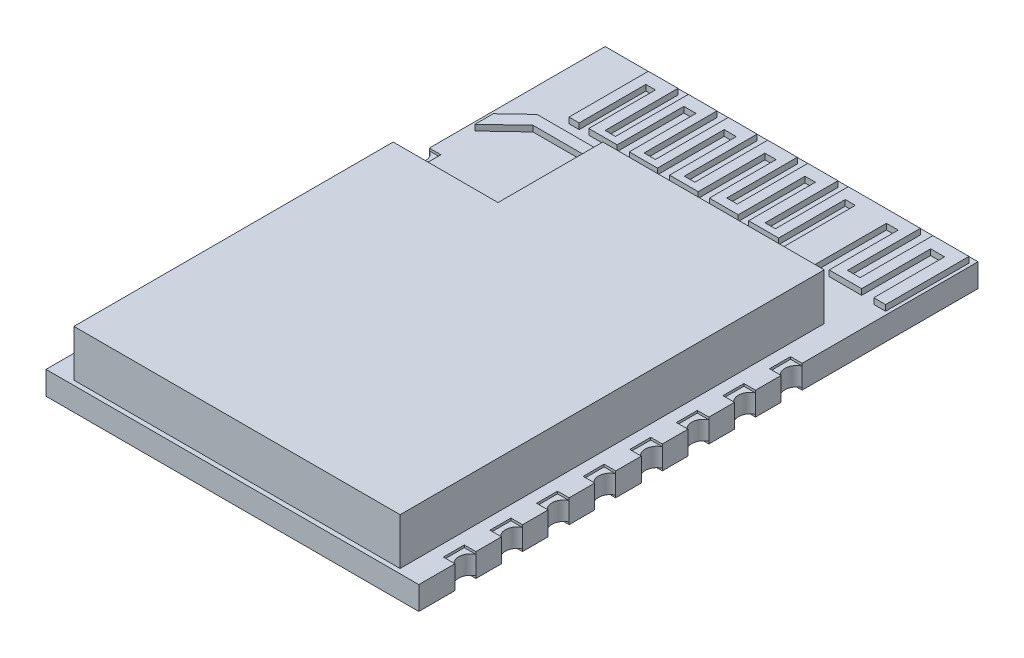
from build123d import *

# Parameters (mm, degrees)
SKETCH_1_W          = 16
SKETCH_1_H          = 24
EXTRUDE_1_DEPTH     = 1
SKETCH_2_W          = 0.497014283
SKETCH_2_H          = 0.9
SKETCH_2_W_2        = 0.5
CUT_EXTRUDE_1_DEPTH = 0.1
SKETCH_3_W          = 1
SKETCH_3_H          = 0.9
CUT_EXTRUDE_2_DEPTH = 0.1
SKETCH_8_W          = 4.7
SKETCH_8_H          = 4.7
CUT_EXTRUDE_3_DEPTH = 0.1
SKETCH_12_R         = 0.2
CUT_EXTRUDE_4_DEPTH = 0.1
SKETCH_13_W         = 4.7
SKETCH_13_H         = 4.7
EXTRUDE_2_DEPTH     = 0.5
SKETCH_15_W         = 4.7
SKETCH_15_H         = 4.7
CUT_EXTRUDE_5_DEPTH = 0.1
SKETCH_16_R         = 0.2
CUT_EXTRUDE_6_DEPTH = 0.25
EXTRUDE_4_DEPTH     = 2
CUT_EXTRUDE_7_DEPTH = 2
SKETCH_19_W         = 14
SKETCH_19_H         = 1.002469934
EXTRUDE_5_DEPTH     = 2
EXTRUDE_7_DEPTH     = 0.25


with BuildPart() as part:
    # 草圖1 → 填料-伸長1 (new body)
    with BuildSketch(Plane(origin=(0, 0, 0), x_dir=(1, 0, 0), z_dir=(0, 1, 0))):
        Rectangle(SKETCH_1_W, SKETCH_1_H)
    extrude(amount=EXTRUDE_1_DEPTH)

    # 草圖2 → 除料-伸長1 (cut)
    with BuildSketch(Plane(origin=(0, 1, 0), x_dir=(1, 0, 0), z_dir=(0, 1, 0))):
        with Locations((-7.751492859, 1.999997771)):
            Rectangle(SKETCH_2_W, SKETCH_2_H)
        with Locations((-7.751492859, -2.229e-06)):
            Rectangle(SKETCH_2_W, SKETCH_2_H)
        with Locations((-7.751492859, -2.000002229)):
            Rectangle(SKETCH_2_W, SKETCH_2_H)
        with Locations((-7.751492859, -4.000002229)):
            Rectangle(SKETCH_2_W, SKETCH_2_H)
        with Locations((-7.751492859, -6.000002229)):
            Rectangle(SKETCH_2_W, SKETCH_2_H)
        with Locations((-7.751492859, -8.000002229)):
            Rectangle(SKETCH_2_W, SKETCH_2_H)
        with Locations((-7.751492859, -10.000002229)):
            Rectangle(SKETCH_2_W, SKETCH_2_H)
        with Locations((7.751492859, -10.000002229)):
            Rectangle(SKETCH_2_W, SKETCH_2_H)
        with Locations((7.751492859, -8.000002229)):
            Rectangle(SKETCH_2_W, SKETCH_2_H)
        with Locations((7.751492859, -6.000002229)):
            Rectangle(SKETCH_2_W, SKETCH_2_H)
        with Locations((7.751492859, -4.000002229)):
            Rectangle(SKETCH_2_W, SKETCH_2_H)
        with Locations((7.751492859, -2.000002229)):
            Rectangle(SKETCH_2_W, SKETCH_2_H)
        with Locations((7.751492859, -2.229e-06)):
            Rectangle(SKETCH_2_W, SKETCH_2_H)
        with Locations((7.751492859, 3.999997771)):
            Rectangle(SKETCH_2_W, SKETCH_2_H)
        with Locations((7.751492859, 1.999997771)):
            Rectangle(SKETCH_2_W, SKETCH_2_H)
        with Locations((-7.752985717, 3.999997771)):
            Rectangle(SKETCH_2_W_2, SKETCH_2_H)
    extrude(amount=-CUT_EXTRUDE_1_DEPTH, mode=Mode.SUBTRACT)

    # 草圖3 → 除料-伸長2 (cut)
    with BuildSketch(Plane.XZ):
        with Locations((7.5, 8)):
            Rectangle(SKETCH_3_W, SKETCH_3_H)
        with Locations((7.5, 10)):
            Rectangle(SKETCH_3_W, SKETCH_3_H)
        with Locations((7.5, 6)):
            Rectangle(SKETCH_3_W, SKETCH_3_H)
        with Locations((7.5, 4)):
            Rectangle(SKETCH_3_W, SKETCH_3_H)
        with Locations((7.5, 2)):
            Rectangle(SKETCH_3_W, SKETCH_3_H)
        with Locations((7.5, 0)):
            Rectangle(SKETCH_3_W, SKETCH_3_H)
        with Locations((7.5, -2)):
            Rectangle(SKETCH_3_W, SKETCH_3_H)
        with Locations((7.5, -4)):
            Rectangle(SKETCH_3_W, SKETCH_3_H)
        with Locations((-7.5, 10)):
            Rectangle(SKETCH_3_W, SKETCH_3_H)
        with Locations((-7.5, -4)):
            Rectangle(SKETCH_3_W, SKETCH_3_H)
        with Locations((-7.5, -2)):
            Rectangle(SKETCH_3_W, SKETCH_3_H)
        with Locations((-7.5, 0)):
            Rectangle(SKETCH_3_W, SKETCH_3_H)
        with Locations((-7.5, 2)):
            Rectangle(SKETCH_3_W, SKETCH_3_H)
        with Locations((-7.5, 4)):
            Rectangle(SKETCH_3_W, SKETCH_3_H)
        with Locations((-7.5, 6)):
            Rectangle(SKETCH_3_W, SKETCH_3_H)
        with Locations((-7.5, 8)):
            Rectangle(SKETCH_3_W, SKETCH_3_H)
    extrude(amount=-CUT_EXTRUDE_2_DEPTH, mode=Mode.SUBTRACT)

    # 草圖8 → 除料-伸長3 (cut)
    with BuildSketch(Plane(origin=(0, 1, 0), x_dir=(1, 0, 0), z_dir=(0, 1, 0))):
        with Locations((1.35, -1.75)):
            Rectangle(SKETCH_8_W, SKETCH_8_H)
    extrude(amount=-CUT_EXTRUDE_3_DEPTH, mode=Mode.SUBTRACT)

    # 草圖12 → 除料-伸長4 (cut)
    with BuildSketch(Plane(origin=(0, 0.9, 0), x_dir=(1, 0, 0), z_dir=(0, 1, 0))):
        with Locations(Location((-0.51, -3.65, 0), (0, 0, 270))):
            Circle(SKETCH_12_R)
        with Locations(Location((0.42, -3.65, 0), (0, 0, 270))):
            Circle(SKETCH_12_R)
        with Locations(Location((1.35, -3.65, 0), (0, 0, 270))):
            Circle(SKETCH_12_R)
        with Locations(Location((2.28, -3.65, 0), (0, 0, 270))):
            Circle(SKETCH_12_R)
        with Locations(Location((3.21, -3.65, 0), (0, 0, 270))):
            Circle(SKETCH_12_R)
        with Locations(Location((-0.51, -2.72, 0), (0, 0, 270))):
            Circle(SKETCH_12_R)
        with Locations(Location((0.42, -2.72, 0), (0, 0, 270))):
            Circle(SKETCH_12_R)
        with Locations(Location((1.35, -2.72, 0), (0, 0, 270))):
            Circle(SKETCH_12_R)
        with Locations(Location((2.28, -2.72, 0), (0, 0, 270))):
            Circle(SKETCH_12_R)
        with Locations(Location((3.21, -2.72, 0), (0, 0, 270))):
            Circle(SKETCH_12_R)
        with Locations(Location((-0.51, -1.79, 0), (0, 0, 270))):
            Circle(SKETCH_12_R)
        with Locations(Location((0.42, -1.79, 0), (0, 0, 270))):
            Circle(SKETCH_12_R)
        with Locations(Location((1.35, -1.79, 0), (0, 0, 270))):
            Circle(SKETCH_12_R)
        with Locations(Location((2.28, -1.79, 0), (0, 0, 270))):
            Circle(SKETCH_12_R)
        with Locations(Location((3.21, -1.79, 0), (0, 0, 270))):
            Circle(SKETCH_12_R)
        with Locations(Location((-0.51, -0.86, 0), (0, 0, 270))):
            Circle(SKETCH_12_R)
        with Locations(Location((0.42, -0.86, 0), (0, 0, 270))):
            Circle(SKETCH_12_R)
        with Locations(Location((1.35, -0.86, 0), (0, 0, 270))):
            Circle(SKETCH_12_R)
        with Locations(Location((2.28, -0.86, 0), (0, 0, 270))):
            Circle(SKETCH_12_R)
        with Locations(Location((3.21, -0.86, 0), (0, 0, 270))):
            Circle(SKETCH_12_R)
        with Locations(Location((-0.51, 0.07, 0), (0, 0, 270))):
            Circle(SKETCH_12_R)
        with Locations(Location((0.42, 0.07, 0), (0, 0, 270))):
            Circle(SKETCH_12_R)
        with Locations(Location((1.35, 0.07, 0), (0, 0, 270))):
            Circle(SKETCH_12_R)
        with Locations(Location((2.28, 0.07, 0), (0, 0, 270))):
            Circle(SKETCH_12_R)
        with Locations(Location((3.21, 0.07, 0), (0, 0, 270))):
            Circle(SKETCH_12_R)
    extrude(amount=-CUT_EXTRUDE_4_DEPTH, mode=Mode.SUBTRACT)

    # 草圖13 → 填料-伸長2 (add)
    with BuildSketch(Plane(origin=(0, 1, 0), x_dir=(1, 0, 0), z_dir=(0, 1, 0))):
        with Locations((1.35, -1.75)):
            Rectangle(SKETCH_13_W, SKETCH_13_H)
    extrude(amount=-EXTRUDE_2_DEPTH)

    # 草圖15 → 除料-伸長5 (cut)
    with BuildSketch(Plane.XZ):
        with Locations((-1.35, 1.75)):
            Rectangle(SKETCH_15_W, SKETCH_15_H)
    extrude(amount=-CUT_EXTRUDE_5_DEPTH, mode=Mode.SUBTRACT)

    # 草圖16 → 除料-伸長6 (cut)
    with BuildSketch(Plane.XZ):
        with Locations(Location((0.51, 3.61, 0), (0, 0, 270))):
            Circle(SKETCH_16_R)
        with Locations(Location((-0.42, 3.61, 0), (0, 0, 270))):
            Circle(SKETCH_16_R)
        with Locations(Location((-1.35, 3.61, 0), (0, 0, 270))):
            Circle(SKETCH_16_R)
        with Locations(Location((-2.28, 3.61, 0), (0, 0, 270))):
            Circle(SKETCH_16_R)
        with Locations(Location((-3.21, 3.61, 0), (0, 0, 270))):
            Circle(SKETCH_16_R)
        with Locations(Location((-3.21, 2.68, 0), (0, 0, 270))):
            Circle(SKETCH_16_R)
        with Locations(Location((-2.28, 2.68, 0), (0, 0, 270))):
            Circle(SKETCH_16_R)
        with Locations(Location((-1.35, 2.68, 0), (0, 0, 270))):
            Circle(SKETCH_16_R)
        with Locations(Location((-0.42, 2.68, 0), (0, 0, 270))):
            Circle(SKETCH_16_R)
        with Locations(Location((0.51, 2.68, 0), (0, 0, 270))):
            Circle(SKETCH_16_R)
        with Locations(Location((-3.21, 1.75, 0), (0, 0, 270))):
            Circle(SKETCH_16_R)
        with Locations(Location((-2.28, 1.75, 0), (0, 0, 270))):
            Circle(SKETCH_16_R)
        with Locations(Location((-1.35, 1.75, 0), (0, 0, 270))):
            Circle(SKETCH_16_R)
        with Locations(Location((-0.42, 1.75, 0), (0, 0, 270))):
            Circle(SKETCH_16_R)
        with Locations(Location((0.51, 1.75, 0), (0, 0, 270))):
            Circle(SKETCH_16_R)
        with Locations(Location((-3.21, 0.82, 0), (0, 0, 270))):
            Circle(SKETCH_16_R)
        with Locations(Location((-2.28, 0.82, 0), (0, 0, 270))):
            Circle(SKETCH_16_R)
        with Locations(Location((-1.35, 0.82, 0), (0, 0, 270))):
            Circle(SKETCH_16_R)
        with Locations(Location((-0.42, 0.82, 0), (0, 0, 270))):
            Circle(SKETCH_16_R)
        with Locations(Location((0.51, 0.82, 0), (0, 0, 270))):
            Circle(SKETCH_16_R)
        with Locations(Location((-3.21, -0.11, 0), (0, 0, 270))):
            Circle(SKETCH_16_R)
        with Locations(Location((-2.28, -0.11, 0), (0, 0, 270))):
            Circle(SKETCH_16_R)
        with Locations(Location((-1.35, -0.11, 0), (0, 0, 270))):
            Circle(SKETCH_16_R)
        with Locations(Location((-0.42, -0.11, 0), (0, 0, 270))):
            Circle(SKETCH_16_R)
        with Locations(Location((0.51, -0.11, 0), (0, 0, 270))):
            Circle(SKETCH_16_R)
    extrude(amount=-CUT_EXTRUDE_6_DEPTH, mode=Mode.SUBTRACT)

    # 草圖17 → 填料-伸長4 (add)
    with BuildSketch(Plane(origin=(0, 1, 0), x_dir=(1, 0, 0), z_dir=(0, 1, 0))):
        Polygon((-2.5, 6.4), (7, 6.4), (7, -10.8), (-7, -10.8), (-7, 1.4), (-7, 1.9), (-2.5, 1.9), align=None)
    extrude(amount=EXTRUDE_4_DEPTH)

    # 草圖18 → 除料-伸長7 (cut)
    with BuildSketch(Plane(origin=(0, 1, 0), x_dir=(1, 0, 0), z_dir=(0, 1, 0))):
        with BuildLine():
            Line((-8, 4.449997771), (-8, 3.549997771))
            ThreePointArc((-8, 3.549997771), (-7.717944947, 3.999997771), (-8, 4.449997771))
        make_face()
        with BuildLine():
            Line((-8, 2.449997771), (-8, 1.549997771))
            ThreePointArc((-8, 1.549997771), (-7.717944947, 1.999997771), (-8, 2.449997771))
        make_face()
        with BuildLine():
            Line((-8, 0.449997771), (-8, -0.450002229))
            ThreePointArc((-8, -0.450002229), (-7.717944947, -2.229e-06), (-8, 0.449997771))
        make_face()
        with BuildLine():
            Line((-8, -1.550002229), (-8, -2.450002229))
            ThreePointArc((-8, -2.450002229), (-7.717944947, -2.000002229), (-8, -1.550002229))
        make_face()
        with BuildLine():
            Line((-8, -3.550002229), (-8, -4.450002229))
            ThreePointArc((-8, -4.450002229), (-7.717944947, -4.000002229), (-8, -3.550002229))
        make_face()
        with BuildLine():
            Line((-8, -5.550002229), (-8, -6.450002229))
            ThreePointArc((-8, -6.450002229), (-7.717944947, -6.000002229), (-8, -5.550002229))
        make_face()
        with BuildLine():
            Line((-8, -7.550002229), (-8, -8.450002229))
            ThreePointArc((-8, -8.450002229), (-7.717944947, -8.000002229), (-8, -7.550002229))
        make_face()
        with BuildLine():
            Line((-8, -9.550002229), (-8, -10.450002229))
            ThreePointArc((-8, -10.450002229), (-7.717944947, -10.000002229), (-8, -9.550002229))
        make_face()
        with BuildLine():
            Line((8, 4.449997771), (8, 3.549997771))
            ThreePointArc((8, 3.549997771), (7.717944947, 3.999997771), (8, 4.449997771))
        make_face()
        with BuildLine():
            Line((8, 2.449997771), (8, 1.549997771))
            ThreePointArc((8, 1.549997771), (7.717944947, 1.999997771), (8, 2.449997771))
        make_face()
        with BuildLine():
            Line((8, 0.449997771), (8, -0.450002229))
            ThreePointArc((8, -0.450002229), (7.717944947, -2.229e-06), (8, 0.449997771))
        make_face()
        with BuildLine():
            Line((8, -1.550002229), (8, -2.450002229))
            ThreePointArc((8, -2.450002229), (7.717944947, -2.000002229), (8, -1.550002229))
        make_face()
        with BuildLine():
            Line((8, -3.550002229), (8, -4.450002229))
            ThreePointArc((8, -4.450002229), (7.717944947, -4.000002229), (8, -3.550002229))
        make_face()
        with BuildLine():
            Line((8, -5.550002229), (8, -6.450002229))
            ThreePointArc((8, -6.450002229), (7.717944947, -6.000002229), (8, -5.550002229))
        make_face()
        with BuildLine():
            Line((8, -7.550002229), (8, -8.450002229))
            ThreePointArc((8, -8.450002229), (7.717944947, -8.000002229), (8, -7.550002229))
        make_face()
        with BuildLine():
            Line((8, -9.550002229), (8, -10.450002229))
            ThreePointArc((8, -10.450002229), (7.717944947, -10.000002229), (8, -9.550002229))
        make_face()
    extrude(amount=-CUT_EXTRUDE_7_DEPTH, mode=Mode.SUBTRACT)

    # 草圖19 → 填料-伸長5 (add)
    with BuildSketch(Plane(origin=(0, 1, 0), x_dir=(1, 0, 0), z_dir=(0, 1, 0))):
        with Locations((0, -11.301234967)):
            Rectangle(SKETCH_19_W, SKETCH_19_H)
    extrude(amount=EXTRUDE_5_DEPTH)

    # 草圖20 → 填料-伸長7 (add)
    with BuildSketch(Plane(origin=(0, 1, 0), x_dir=(1, 0, 0), z_dir=(0, 1, 0))):
        Polygon((2.774577228, 7.299411594), (2.774577228, 6.4), (2.25, 6.4), (2.233327616, 7.273314493), (-6.374311064, 7.273314493), (-7.570925376, 6.142787442), (-7.655150085, 6.06321434), (-7.655150085, 6.074907725), (-7.655150085, 6.142787442), (-7.655150085, 6.849705797), (-6.687394801, 7.76401337), (3.522967128, 7.76401337), (3.522967128, 11.214195738), (3.088020933, 11.214195738), (3.088020933, 8.351190734), (1.804929657, 8.351190734), (1.804929657, 11.214195738), (1.359109808, 11.214195738), (1.359109808, 8.351190734), (0.119513152, 8.351190734), (0.119513152, 11.214195738), (-0.358927663, 11.214195738), (-0.358927663, 8.351190734), (-1.587650664, 8.351190734), (-1.587650664, 11.214195738), (-2.109586098, 11.214195738), (-2.109586098, 8.351190734), (-3.316561789, 8.351190734), (-3.316561789, 11.214195738), (-3.838497223, 11.214195738), (-3.838497223, 8.351190734), (-5.056346569, 8.351190734), (-5.056346569, 11.214195738), (-5.469545455, 11.214195738), (-5.469545455, 8.351190734), (-5.90449165, 8.351190734), (-5.90449165, 11.755615709), (-4.632274029, 11.755615709), (-4.632274029, 8.628639144), (-4.185197949, 8.628639144), (-4.185197949, 11.755615709), (-2.958715974, 11.755615709), (-2.958715974, 8.628639144), (-2.472542939, 8.628639144), (-2.472542939, 11.755615709), (-1.235011578, 11.755615709), (-1.235011578, 8.628639144), (-0.781986705, 8.628639144), (-0.781986705, 11.755615709), (0.488692818, 11.755615709), (0.488692818, 8.728083628), (0.941717692, 8.728083628), (0.941717692, 11.755615709), (2.234495989, 11.755615709), (2.234495989, 8.628639144), (2.676471475, 8.628639144), (2.676471475, 11.755615709), (5.770299878, 11.755615709), (5.770299878, 8.628639144), (5.858694976, 8.628639144), (6.311719849, 8.628639144), (6.311719849, 11.755615709), (7.858634051, 11.755615709), (7.858634051, 8.17561427), (7.350362242, 8.17561427), (7.350362242, 11.214195738), (6.753695335, 11.214195738), (6.753695335, 8.25295998), (5.361472554, 8.25295998), (5.361472554, 11.214195738), (4.855655638, 11.214195738), (4.855655638, 7.299411594), align=None)
    extrude(amount=EXTRUDE_7_DEPTH)


solid = part.part
